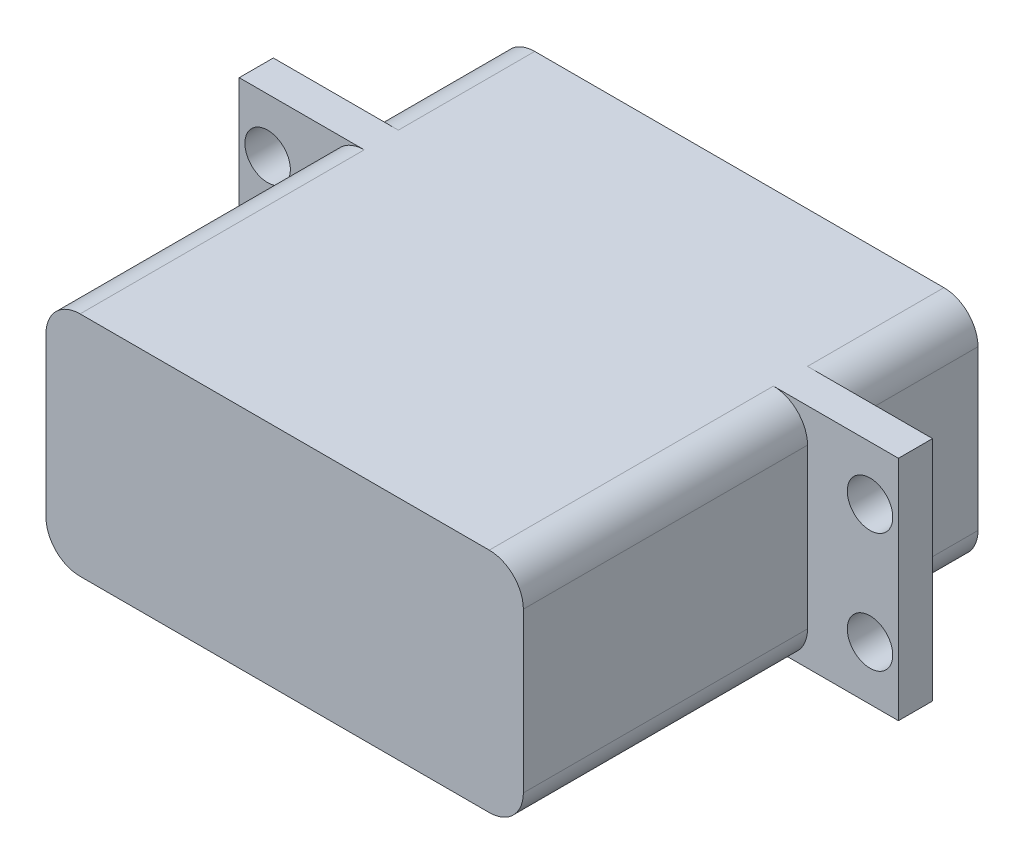
from build123d import *

# Parameters (mm, degrees)
EXTRUDE_1_DEPTH     = 40
EXTRUDE_2_DEPTH     = 3
SKETCH_4_R          = 2
CUT_EXTRUDE_1_DEPTH = 3
SKETCH_5_R          = 3
EXTRUDE_3_DEPTH     = 5.5


with BuildPart() as part:
    # 草图1 → 凸台-拉伸1 (new body)
    with BuildSketch(Plane.XY):
        with BuildLine():
            Line((3, 0), (39, 0))
            ThreePointArc((39, 0), (41.121320344, -0.878679656), (42, -3))
            Line((42, -3), (42, -17))
            ThreePointArc((42, -17), (41.121320344, -19.121320344), (39, -20))
            Line((39, -20), (3, -20))
            ThreePointArc((3, -20), (0.878679656, -19.121320344), (0, -17))
            Line((0, -17), (0, -3))
            ThreePointArc((0, -3), (0.878679656, -0.878679656), (3, 0))
        make_face()
    extrude(amount=EXTRUDE_1_DEPTH)

    # 草图3 → 凸台-拉伸2 (add)
    with BuildSketch(Plane.XY.offset(12)):
        with BuildLine():
            Line((3, 0), (-8, 0))
            Line((-8, 0), (-8, -20))
            Line((-8, -20), (3, -20))
            ThreePointArc((3, -20), (0.878679656, -19.121320344), (0, -17))
            Line((0, -17), (0, -3))
            ThreePointArc((0, -3), (0.878679656, -0.878679656), (3, 0))
        make_face()
        with BuildLine():
            Line((42, -3), (42, -17))
            ThreePointArc((42, -17), (41.121320344, -19.121320344), (39, -20))
            Line((39, -20), (50, -20))
            Line((50, -20), (50, 0))
            Line((50, 0), (39, 0))
            ThreePointArc((39, 0), (41.121320344, -0.878679656), (42, -3))
        make_face()
    extrude(amount=EXTRUDE_2_DEPTH)

    # 草图4 → 切除-拉伸1 (cut)
    with BuildSketch(Plane(origin=(0, 0, 12), x_dir=(-1, 0, 0), z_dir=(0, 0, -1))):
        with Locations((5.5, -4.75)):
            Circle(SKETCH_4_R)
        with Locations((5.5, -15.25)):
            Circle(SKETCH_4_R)
        with Locations((-47.5, -4.75)):
            Circle(SKETCH_4_R)
        with Locations((-47.5, -15.25)):
            Circle(SKETCH_4_R)
    extrude(amount=-CUT_EXTRUDE_1_DEPTH, mode=Mode.SUBTRACT)

    # 草图5 → 凸台-拉伸3 (add)
    with BuildSketch(Plane(origin=(0, 0, 0), x_dir=(-1, 0, 0), z_dir=(0, 0, -1))):
        with Locations(Location((-10, -10, 0), (0, 0, 180))):
            Circle(SKETCH_5_R)
    extrude(amount=EXTRUDE_3_DEPTH)


solid = part.part
